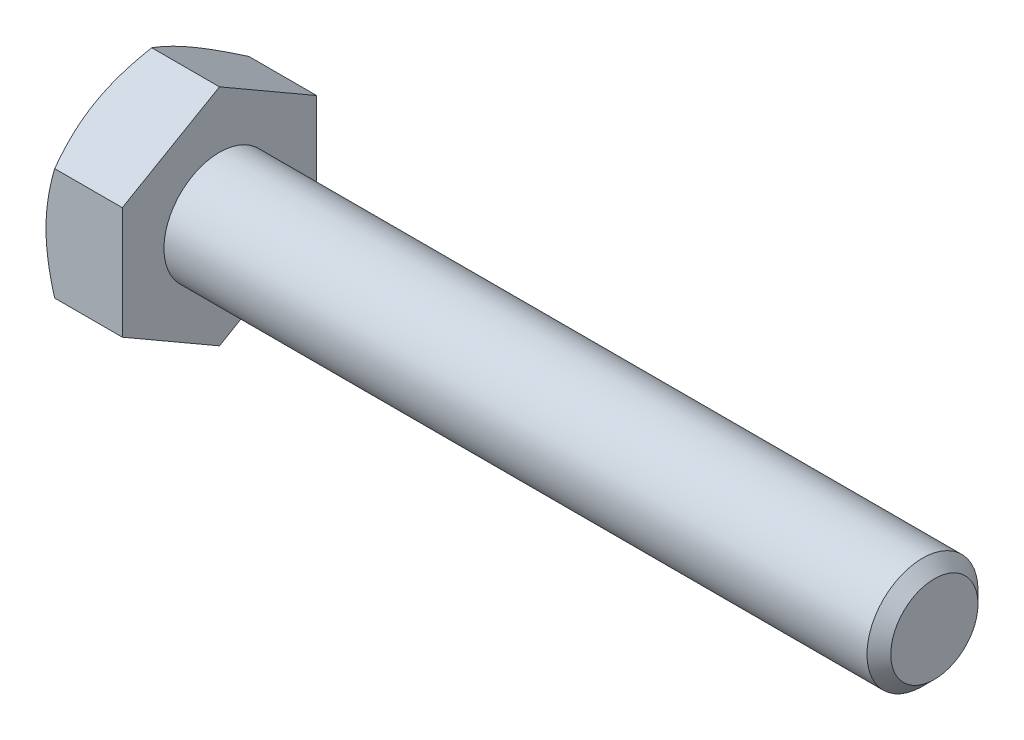
from build123d import *

# Parameters (mm, degrees)
SKETCH5_R           = 3.175
BOSS_EXTRUDE3_DEPTH = 40.894
CHAMFER1_SIZE       = 0.680357143
BOSS_EXTRUDE4_DEPTH = 4.365625
SKETCH8_OUTSIDE_W   = 185.76
SKETCH8_OUTSIDE_H   = 187.48
SKETCH8_OUTSIDE_R   = 5.55625
CUT_EXTRUDE3_DEPTH  = 47.048540925
CUT_EXTRUDE3_DRAFT  = -60


with BuildPart() as part:
    # Sketch5 → Boss-Extrude3 (new body)
    with BuildSketch(Plane(origin=(22.6298125, 0, 0), x_dir=(0, 0, -1), z_dir=(1, 0, 0))):
        Circle(SKETCH5_R)
    extrude(amount=-BOSS_EXTRUDE3_DEPTH)

    # Chamfer1
    chamfer1_edges = [part.edges().sort_by_distance(p)[0] for p in [
        (22.6298125, 0, 3.175),
    ]]
    chamfer(chamfer1_edges, length=CHAMFER1_SIZE)

    # Sketch6 → Boss-Extrude4 (add)
    with BuildSketch(Plane.ZY.offset(18.2641875)):
        Polygon((5.55625, 3.207902433), (0, 6.415804866), (-5.55625, 3.207902433), (-5.55625, -3.207902433), (0, -6.415804866), (5.55625, -3.207902433), align=None)
    extrude(amount=BOSS_EXTRUDE4_DEPTH)


with BuildPart() as cut_extrude3_tool:
    # Sketch8 outside → Cut-Extrude3 (with draft: the straight prism first)
    with BuildSketch(Plane.ZY.offset(22.6298125)):
        Rectangle(SKETCH8_OUTSIDE_W, SKETCH8_OUTSIDE_H)
        Circle(SKETCH8_OUTSIDE_R, mode=Mode.SUBTRACT)
    extrude(amount=-CUT_EXTRUDE3_DEPTH)
    # Cut-Extrude3: the draft: its side faces are tilted about the plane it starts from
    cut_extrude3_sides = [cut_extrude3_tool.faces().sort_by_distance(p)[0] for p in [
        (0.894457962, -93.74, 0),
        (0.894457962, 0, 92.88),
        (0.894457962, 93.74, 0),
        (0.894457962, 0, -92.88),
        (0.894457962, 0, -5.55625),
    ]]
    draft(cut_extrude3_sides, Plane.ZY.offset(22.6298125), CUT_EXTRUDE3_DRAFT)


with BuildPart() as part_1:
    add(part.part)

    # Cut-Extrude3: cut by cut_extrude3_tool
    add(cut_extrude3_tool.part, mode=Mode.SUBTRACT)


solid = part_1.part
